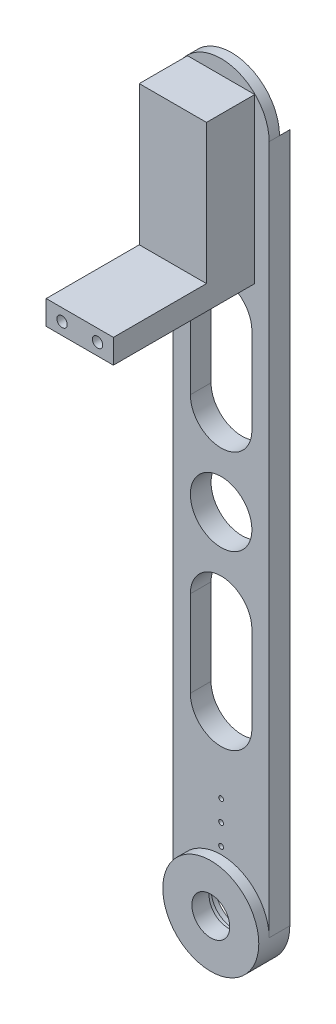
from build123d import *

# Parameters (mm, degrees)
ESQUISSE1_W              = 27.85
ESQUISSE1_H              = 200
BOSS_EXTRU_1_DEPTH       = 6
ENL_V_START              = -3
ESQUISSE2_R              = 13.925
ENL_V_MAT_EXTRU_1_DEPTH  = 3
ESQUISSE3_R              = 13.925
ENL_V_MAT_EXTRU_2_DEPTH  = 3
ESQUISSE5_R              = 8.925
ENL_V_MAT_EXTRU_3_DEPTH  = 10
ESQUISSE4_W              = 19.5
ESQUISSE4_H              = 40.5
ESQUISSE4_R              = 2.5
BOSS_EXTRU_2_DEPTH       = 14
ESQUISSE6_W              = 19.5
ESQUISSE6_H              = 7
ESQUISSE6_R              = 1.5
BOSS_EXTRU_3_DEPTH       = 41
ESQUISSE7_R              = 2.925
ENL_V_MAT_EXTRU_4_DEPTH  = 10
ESQUISSE8_R              = 2.925
ENL_V_MAT_EXTRU_5_DEPTH  = 3
ESQUISSE9_R              = 13.925
BOSS_EXTRU_4_DEPTH       = 6
ENL_V_START_2            = -6
ESQUISSE10_R             = 2.925
ENL_V_MAT_EXTRU_6_DEPTH  = 6
ESQUISSE11_R             = 2.925
ENL_V_MAT_EXTRU_7_DEPTH  = 2.4
ESQUISSE12_R             = 5.5
ESQUISSE12_R_2           = 2.925
ENL_V_MAT_EXTRU_9_DEPTH  = 1.6
ESQUISSE13_R             = 5.5
ENL_V_MAT_EXTRU_10_DEPTH = 5
ESQUISSE14_R             = 0.7
ENL_V_MAT_EXTRU_11_DEPTH = 45


with BuildPart() as part:
    # Esquisse1 → Boss.-Extru.1 (new body)
    with BuildSketch(Plane.XY):
        with Locations((41.042105263, 90.919078947)):
            Rectangle(ESQUISSE1_W, ESQUISSE1_H)
        with BuildLine():
            Line((27.117105263, -9.080921053), (54.967105263, -9.080921053))
            ThreePointArc((54.967105263, -9.080921053), (41.042105263, -23.005921053), (27.117105263, -9.080921053))
        make_face()
        with BuildLine():
            ThreePointArc((27.117105263, 190.919078947), (41.042105263, 204.844078947), (54.967105263, 190.919078947))
            Line((54.967105263, 190.919078947), (27.117105263, 190.919078947))
        make_face()
    extrude(amount=BOSS_EXTRU_1_DEPTH)

    # Esquisse2 → Enlèv. mat.-Extru.1 (cut)
    with BuildSketch(Plane.XY.offset(6).offset(ENL_V_START)):
        with Locations((41.042105263, -9.080921053)):
            Circle(ESQUISSE2_R)
    extrude(amount=ENL_V_MAT_EXTRU_1_DEPTH, mode=Mode.SUBTRACT)

    # Esquisse3 → Enlèv. mat.-Extru.2 (cut)
    with BuildSketch(Plane(origin=(0, 0, 0), x_dir=(-1, 0, 0), z_dir=(0, 0, -1))):
        with Locations((-41.042105263, 190.919078947)):
            Circle(ESQUISSE3_R)
    extrude(amount=-ENL_V_MAT_EXTRU_2_DEPTH, mode=Mode.SUBTRACT)

    # Esquisse5 → Enlèv. mat.-Extru.3 (cut)
    with BuildSketch(Plane.XY.offset(6)):
        with Locations((41.042105263, 90.919078947)):
            Circle(ESQUISSE5_R)
        with BuildLine():
            Line((32.117105263, 65.919078947), (32.117105263, 40.919078947))
            ThreePointArc((32.117105263, 40.919078947), (41.042105263, 31.994078947), (49.967105263, 40.919078947))
            Line((49.967105263, 40.919078947), (49.967105263, 65.919078947))
            ThreePointArc((49.967105263, 65.919078947), (41.042105263, 74.844078947), (32.117105263, 65.919078947))
        make_face()
        with BuildLine():
            Line((32.117105263, 140.919078947), (32.117105263, 115.919078947))
            ThreePointArc((32.117105263, 115.919078947), (41.042105263, 106.994078947), (49.967105263, 115.919078947))
            Line((49.967105263, 115.919078947), (49.967105263, 140.919078947))
            ThreePointArc((49.967105263, 140.919078947), (41.042105263, 149.844078947), (32.117105263, 140.919078947))
        make_face()
    extrude(amount=-ENL_V_MAT_EXTRU_3_DEPTH, mode=Mode.SUBTRACT)

    # Esquisse4 → Boss.-Extru.2 (add)
    # profile 1 of 2: a face of its own
    with BuildSketch(Plane.XY.offset(6)):
        with Locations((41.042105263, 180.419078947)):
            Rectangle(ESQUISSE4_W, ESQUISSE4_H)
        with Locations((41.042105263, 190.919078947)):
            Circle(ESQUISSE4_R, mode=Mode.SUBTRACT)
    # profile 2 of 2: a face of its own
    with BuildSketch(Plane.XY.offset(6)):
        with Locations((41.042105263, 190.919078947)):
            Circle(ESQUISSE4_R)
    extrude(amount=BOSS_EXTRU_2_DEPTH)

    # Esquisse6 → Boss.-Extru.3 (add)
    with BuildSketch(Plane.XY.offset(6)):
        with Locations((41.042105263, 156.669078947)):
            Rectangle(ESQUISSE6_W, ESQUISSE6_H)
        with Locations((35.892105263, 156.669078947)):
            Circle(ESQUISSE6_R, mode=Mode.SUBTRACT)
        with Locations((46.192105263, 156.669078947)):
            Circle(ESQUISSE6_R, mode=Mode.SUBTRACT)
    extrude(amount=BOSS_EXTRU_3_DEPTH)

    # Esquisse7 → Enlèv. mat.-Extru.4 (cut)
    with BuildSketch(Plane(origin=(0, 0, 0), x_dir=(-1, 0, 0), z_dir=(0, 0, -1))):
        with Locations((-41.042105263, -9.080921053)):
            Circle(ESQUISSE7_R)
    extrude(amount=-ENL_V_MAT_EXTRU_4_DEPTH, mode=Mode.SUBTRACT)

    # Esquisse8 → Enlèv. mat.-Extru.5 (cut)
    with BuildSketch(Plane(origin=(0, 0, 3), x_dir=(-1, 0, 0), z_dir=(0, 0, -1))):
        with Locations((-41.042105263, 190.919078947)):
            Circle(ESQUISSE8_R)
    extrude(amount=-ENL_V_MAT_EXTRU_5_DEPTH, mode=Mode.SUBTRACT)

    # Esquisse9 → Boss.-Extru.4 (add)
    with BuildSketch(Plane.XY.offset(3)):
        with Locations((41.042105263, -9.080921053)):
            Circle(ESQUISSE9_R)
    extrude(amount=BOSS_EXTRU_4_DEPTH)

    # Esquisse10 → Enlèv. mat.-Extru.6 (cut)
    with BuildSketch(Plane.XY.offset(9).offset(ENL_V_START_2)):
        with Locations(Location((41.042105263, -9.080921053, 0), (0, 0, 180))):
            Circle(ESQUISSE10_R)
    extrude(amount=ENL_V_MAT_EXTRU_6_DEPTH, mode=Mode.SUBTRACT)

    # Esquisse11 → Enlèv. mat.-Extru.7 (cut)
    with BuildSketch(Plane(origin=(0, 0, 0), x_dir=(-1, 0, 0), z_dir=(0, 0, -1))):
        with BuildLine():
            Line((-33.042105263, -9.080921053), (-36.942105263, 19.119078947))
            ThreePointArc((-36.942105263, 19.119078947), (-41.042105263, 23.219078947), (-45.142105263, 19.119078947))
            Line((-45.142105263, 19.119078947), (-49.042105263, -9.080921053))
            ThreePointArc((-49.042105263, -9.080921053), (-41.042105263, -17.080921053), (-33.042105263, -9.080921053))
        make_face()
        with Locations((-41.042105263, -9.080921053)):
            Circle(ESQUISSE11_R, mode=Mode.SUBTRACT)
    extrude(amount=-ENL_V_MAT_EXTRU_7_DEPTH, mode=Mode.SUBTRACT)

    # Esquisse12 → Enlèv. mat.-Extru.9 (cut)
    # profile 1 of 7: a face of its own
    with BuildSketch(Plane(origin=(0, 0, 2.4), x_dir=(-1, 0, 0), z_dir=(0, 0, -1))):
        with BuildLine():
            Line((-46.542105263, 3.119078947), (-46.542105263, -5.616819437))
            ThreePointArc((-46.542105263, -5.616819437), (-45.653305434, -4.499782223), (-44.542105263, -3.603695478))
            Line((-44.542105263, -3.603695478), (-44.542105263, 3.119078947))
            Line((-44.542105263, 3.119078947), (-46.542105263, 3.119078947))
        make_face()
    # profile 2 of 7: a face of its own
    with BuildSketch(Plane(origin=(0, 0, 2.4), x_dir=(-1, 0, 0), z_dir=(0, 0, -1))):
        with BuildLine():
            ThreePointArc((-37.542105263, -3.603695478), (-36.430905092, -4.499782223), (-35.542105263, -5.616819437))
            Line((-35.542105263, -5.616819437), (-35.542105263, 2.919078947))
            Line((-35.542105263, 2.919078947), (-37.542105263, 2.919078947))
            Line((-37.542105263, 2.919078947), (-37.542105263, -3.603695478))
        make_face()
    # profile 3 of 7: a face of its own
    with BuildSketch(Plane(origin=(0, 0, 2.4), x_dir=(-1, 0, 0), z_dir=(0, 0, -1))):
        with BuildLine():
            ThreePointArc((-37.542105263, -4.838280366), (-36.067168078, -6.735713173), (-35.542105263, -9.080921053))
            Line((-35.542105263, -9.080921053), (-35.542105263, -5.616819437))
            ThreePointArc((-35.542105263, -5.616819437), (-36.430905092, -4.499782223), (-37.542105263, -3.603695478))
            Line((-37.542105263, -3.603695478), (-37.542105263, -4.838280366))
        make_face()
    # profile 4 of 7: a face of its own
    with BuildSketch(Plane(origin=(0, 0, 2.4), x_dir=(-1, 0, 0), z_dir=(0, 0, -1))):
        with BuildLine():
            ThreePointArc((-35.542105263, -9.080921053), (-41.042105263, -14.580921053), (-46.542105263, -9.080921053))
            Line((-46.542105263, -9.080921053), (-46.542105263, -5.616819437))
            ThreePointArc((-46.542105263, -5.616819437), (-42.844880901, -15.325919051), (-34.542105263, -9.080921053))
            ThreePointArc((-34.542105263, -9.080921053), (-34.797107265, -7.278145415), (-35.542105263, -5.616819437))
            Line((-35.542105263, -5.616819437), (-35.542105263, -9.080921053))
        make_face()
    # profile 5 of 7: a face of its own
    with BuildSketch(Plane(origin=(0, 0, 2.4), x_dir=(-1, 0, 0), z_dir=(0, 0, -1))):
        with BuildLine():
            Line((-46.542105263, -5.616819437), (-46.542105263, -9.080921053))
            ThreePointArc((-46.542105263, -9.080921053), (-46.017042449, -6.735713173), (-44.542105263, -4.838280366))
            Line((-44.542105263, -4.838280366), (-44.542105263, -3.603695478))
            ThreePointArc((-44.542105263, -3.603695478), (-45.653305434, -4.499782223), (-46.542105263, -5.616819437))
        make_face()
    # profile 6 of 7: a face of its own
    with BuildSketch(Plane(origin=(0, 0, 2.4), x_dir=(-1, 0, 0), z_dir=(0, 0, -1))):
        with BuildLine():
            Line((-44.542105263, -3.603695478), (-44.542105263, -4.838280366))
            ThreePointArc((-44.542105263, -4.838280366), (-41.042105263, -3.580921053), (-37.542105263, -4.838280366))
            Line((-37.542105263, -4.838280366), (-37.542105263, -3.603695478))
            ThreePointArc((-37.542105263, -3.603695478), (-41.042105263, -2.580921053), (-44.542105263, -3.603695478))
        make_face()
    # profile 7 of 7: a face of its own
    with BuildSketch(Plane(origin=(0, 0, 2.4), x_dir=(-1, 0, 0), z_dir=(0, 0, -1))):
        with Locations((-41.042105263, -9.080921053)):
            Circle(ESQUISSE12_R)
        with Locations((-41.042105263, -9.080921053)):
            Circle(ESQUISSE12_R_2, mode=Mode.SUBTRACT)
    extrude(amount=-ENL_V_MAT_EXTRU_9_DEPTH, mode=Mode.SUBTRACT)

    # Esquisse13 → Enlèv. mat.-Extru.10 (cut)
    with BuildSketch(Plane(origin=(0, 0, 4), x_dir=(-1, 0, 0), z_dir=(0, 0, -1))):
        with Locations((-41.042105263, -9.080921053)):
            Circle(ESQUISSE13_R)
    extrude(amount=-ENL_V_MAT_EXTRU_10_DEPTH, mode=Mode.SUBTRACT)

    # Esquisse14 → Enlèv. mat.-Extru.11 (cut)
    with BuildSketch(Plane(origin=(0, 0, 2.4), x_dir=(-1, 0, 0), z_dir=(0, 0, -1))):
        with Locations((-41.042105263, 6.919078947)):
            Circle(ESQUISSE14_R)
        with Locations((-41.042105263, 12.919078947)):
            Circle(ESQUISSE14_R)
        with Locations((-41.042105263, 18.919078947)):
            Circle(ESQUISSE14_R)
    extrude(amount=-ENL_V_MAT_EXTRU_11_DEPTH, mode=Mode.SUBTRACT)


solid = part.part
